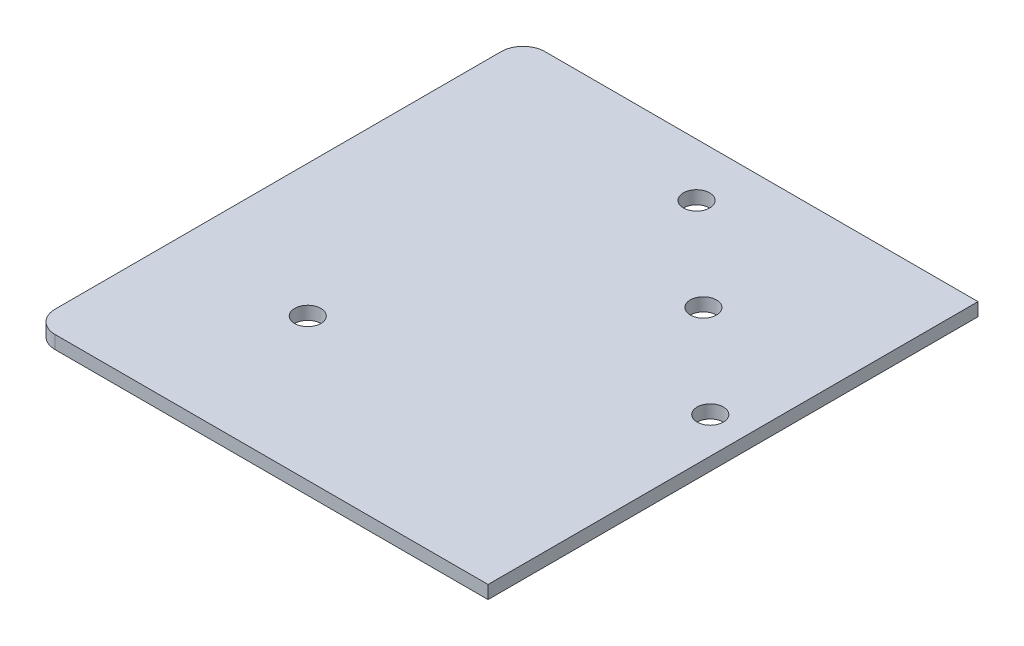
from build123d import *

# Parameters (mm, degrees)
BOSS_EXTRUDE1_DEPTH = 9.525
BOSS_EXTRUDE2_DEPTH = 9.525
FILLET1_R           = 15.875
SKETCH3_R           = 9.525
CUT_EXTRUDE2_DEPTH  = 587.481888574


with BuildPart() as part:
    # Sketch1 → Boss-Extrude1 (new body)
    with BuildSketch(Plane(origin=(0, 0, 0), x_dir=(1, 0, 0), z_dir=(0, 1, 0))):
        Polygon((461.512355724, 17.636671785), (558.8, 99.270698215), (558.8, 177.8), (228.6, 177.8), (228.6, -177.8), align=None)
    extrude(amount=BOSS_EXTRUDE1_DEPTH)

    # Sketch1<4> → Boss-Extrude2 (add)
    with BuildSketch(Plane(origin=(0, 0, 0), x_dir=(1, 0, 0), z_dir=(0, 1, 0))):
        Polygon((558.8, -177.8), (558.8, 99.270698215), (461.512355724, 17.636671785), (228.6, -177.8), align=None)
    extrude(amount=BOSS_EXTRUDE2_DEPTH)

    # Fillet1
    fillet1_edges = [part.edges().sort_by_distance(p)[0] for p in [
        (228.6, 4.7625, 177.8),
        (228.6, 4.7625, -177.8),
    ]]
    fillet(fillet1_edges, radius=FILLET1_R)

    # Sketch3 → Cut-Extrude2 (cut, through all)
    with BuildSketch(Plane.XZ):
        with Locations((532.632411773, -9.638851534)):
            Circle(SKETCH3_R)
        with Locations((393.035251618, -139.264785964)):
            Circle(SKETCH3_R)
        with Locations((462.833831696, -74.451818749)):
            Circle(SKETCH3_R)
        with Locations((324.566168304, 74.451818749)):
            Circle(SKETCH3_R)
    extrude(amount=-CUT_EXTRUDE2_DEPTH, mode=Mode.SUBTRACT)


solid = part.part
